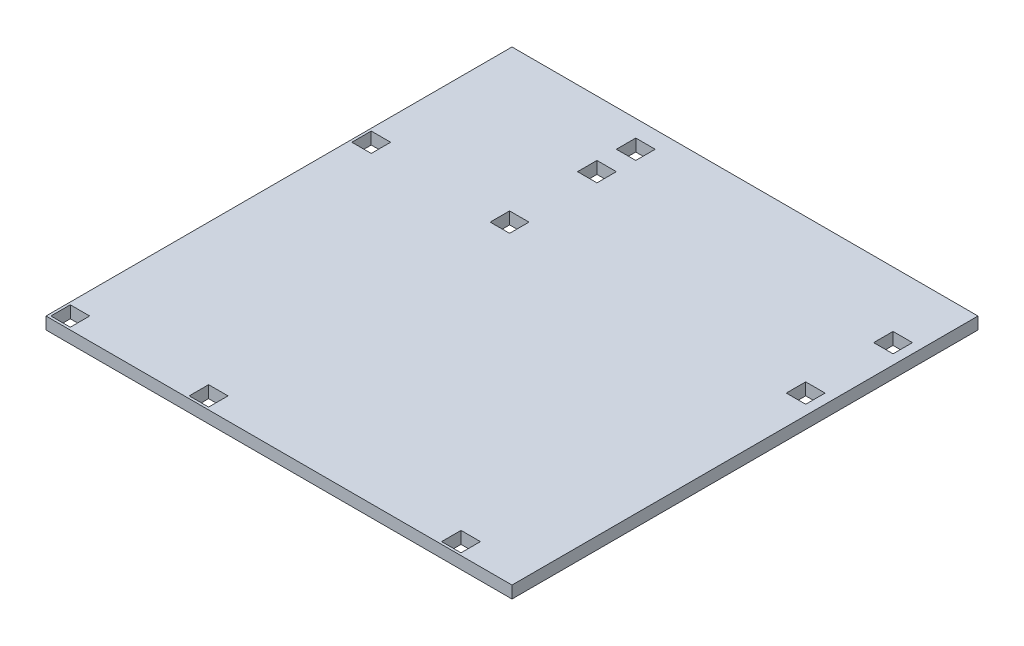
from build123d import *

# Parameters (mm, degrees)
SKETCH1_W           = 243.84
SKETCH1_H           = 243.84
BOSS_EXTRUDE1_DEPTH = 6.35
CUT_EXTRUDE1_REACH  = 346.9
SKETCH5_W           = 10.16
SKETCH5_H           = 10.16


with BuildPart() as part:
    # Sketch1 → Boss-Extrude1 (new body)
    with BuildSketch(Plane(origin=(0, 0, 0), x_dir=(1, 0, 0), z_dir=(0, 1, 0))):
        with Locations((121.92, 121.92)):
            Rectangle(SKETCH1_W, SKETCH1_H)
    extrude(amount=BOSS_EXTRUDE1_DEPTH)

    # Sketch5 → Cut-Extrude1 (cut, up to next)
    with BuildSketch(Plane(origin=(0, 6.35, 0), x_dir=(1, 0, 0), z_dir=(0, 1, 0)), mode=Mode.PRIVATE) as cut_extrude1_sk1:
        with Locations((6.35, 6.35)):
            Rectangle(SKETCH5_W, SKETCH5_H)
    cut_extrude1_tool1 = extrude(cut_extrude1_sk1.sketch, amount=-CUT_EXTRUDE1_REACH, mode=Mode.PRIVATE) & part.part
    # Sketch5 → Cut-Extrude1 (cut, up to next)
    with BuildSketch(Plane(origin=(0, 6.35, 0), x_dir=(1, 0, 0), z_dir=(0, 1, 0)), mode=Mode.PRIVATE) as cut_extrude1_sk2:
        with Locations((78.74, 6.35)):
            Rectangle(SKETCH5_W, SKETCH5_H)
    cut_extrude1_tool2 = extrude(cut_extrude1_sk2.sketch, amount=-CUT_EXTRUDE1_REACH, mode=Mode.PRIVATE) & part.part
    # Sketch5 → Cut-Extrude1 (cut, up to next)
    with BuildSketch(Plane(origin=(0, 6.35, 0), x_dir=(1, 0, 0), z_dir=(0, 1, 0)), mode=Mode.PRIVATE) as cut_extrude1_sk3:
        with Locations((210.82, 6.35)):
            Rectangle(SKETCH5_W, SKETCH5_H)
    cut_extrude1_tool3 = extrude(cut_extrude1_sk3.sketch, amount=-CUT_EXTRUDE1_REACH, mode=Mode.PRIVATE) & part.part
    # Sketch5 → Cut-Extrude1 (cut, up to next)
    with BuildSketch(Plane(origin=(0, 6.35, 0), x_dir=(1, 0, 0), z_dir=(0, 1, 0)), mode=Mode.PRIVATE) as cut_extrude1_sk4:
        with Locations((233.68, 163.83)):
            Rectangle(SKETCH5_W, SKETCH5_H)
    cut_extrude1_tool4 = extrude(cut_extrude1_sk4.sketch, amount=-CUT_EXTRUDE1_REACH, mode=Mode.PRIVATE) & part.part
    # Sketch5 → Cut-Extrude1 (cut, up to next)
    with BuildSketch(Plane(origin=(0, 6.35, 0), x_dir=(1, 0, 0), z_dir=(0, 1, 0)), mode=Mode.PRIVATE) as cut_extrude1_sk5:
        with Locations((233.68, 209.55)):
            Rectangle(SKETCH5_W, SKETCH5_H)
    cut_extrude1_tool5 = extrude(cut_extrude1_sk5.sketch, amount=-CUT_EXTRUDE1_REACH, mode=Mode.PRIVATE) & part.part
    # Sketch5 → Cut-Extrude1 (cut, up to next)
    with BuildSketch(Plane(origin=(0, 6.35, 0), x_dir=(1, 0, 0), z_dir=(0, 1, 0)), mode=Mode.PRIVATE) as cut_extrude1_sk6:
        with Locations((78.74, 209.55)):
            Rectangle(SKETCH5_W, SKETCH5_H)
    cut_extrude1_tool6 = extrude(cut_extrude1_sk6.sketch, amount=-CUT_EXTRUDE1_REACH, mode=Mode.PRIVATE) & part.part
    # Sketch5 → Cut-Extrude1 (cut, up to next)
    with BuildSketch(Plane(origin=(0, 6.35, 0), x_dir=(1, 0, 0), z_dir=(0, 1, 0)), mode=Mode.PRIVATE) as cut_extrude1_sk7:
        with Locations((78.74, 163.83)):
            Rectangle(SKETCH5_W, SKETCH5_H)
    cut_extrude1_tool7 = extrude(cut_extrude1_sk7.sketch, amount=-CUT_EXTRUDE1_REACH, mode=Mode.PRIVATE) & part.part
    # Sketch5 → Cut-Extrude1 (cut, up to next)
    with BuildSketch(Plane(origin=(0, 6.35, 0), x_dir=(1, 0, 0), z_dir=(0, 1, 0)), mode=Mode.PRIVATE) as cut_extrude1_sk8:
        with Locations((6.35, 163.83)):
            Rectangle(SKETCH5_W, SKETCH5_H)
    cut_extrude1_tool8 = extrude(cut_extrude1_sk8.sketch, amount=-CUT_EXTRUDE1_REACH, mode=Mode.PRIVATE) & part.part
    # Sketch5 → Cut-Extrude1 (cut, up to next)
    with BuildSketch(Plane(origin=(0, 6.35, 0), x_dir=(1, 0, 0), z_dir=(0, 1, 0)), mode=Mode.PRIVATE) as cut_extrude1_sk9:
        with Locations((78.74, 229.87)):
            Rectangle(SKETCH5_W, SKETCH5_H)
    cut_extrude1_tool9 = extrude(cut_extrude1_sk9.sketch, amount=-CUT_EXTRUDE1_REACH, mode=Mode.PRIVATE) & part.part
    add(cut_extrude1_tool1.solids().sort_by_distance((6.35, 6.35, -6.35))[0], mode=Mode.SUBTRACT)
    add(cut_extrude1_tool2.solids().sort_by_distance((78.74, 6.35, -6.35))[0], mode=Mode.SUBTRACT)
    add(cut_extrude1_tool3.solids().sort_by_distance((210.82, 6.35, -6.35))[0], mode=Mode.SUBTRACT)
    add(cut_extrude1_tool4.solids().sort_by_distance((233.68, 6.35, -163.83))[0], mode=Mode.SUBTRACT)
    add(cut_extrude1_tool5.solids().sort_by_distance((233.68, 6.35, -209.55))[0], mode=Mode.SUBTRACT)
    add(cut_extrude1_tool6.solids().sort_by_distance((78.74, 6.35, -209.55))[0], mode=Mode.SUBTRACT)
    add(cut_extrude1_tool7.solids().sort_by_distance((78.74, 6.35, -163.83))[0], mode=Mode.SUBTRACT)
    add(cut_extrude1_tool8.solids().sort_by_distance((6.35, 6.35, -163.83))[0], mode=Mode.SUBTRACT)
    add(cut_extrude1_tool9.solids().sort_by_distance((78.74, 6.35, -229.87))[0], mode=Mode.SUBTRACT)


solid = part.part
